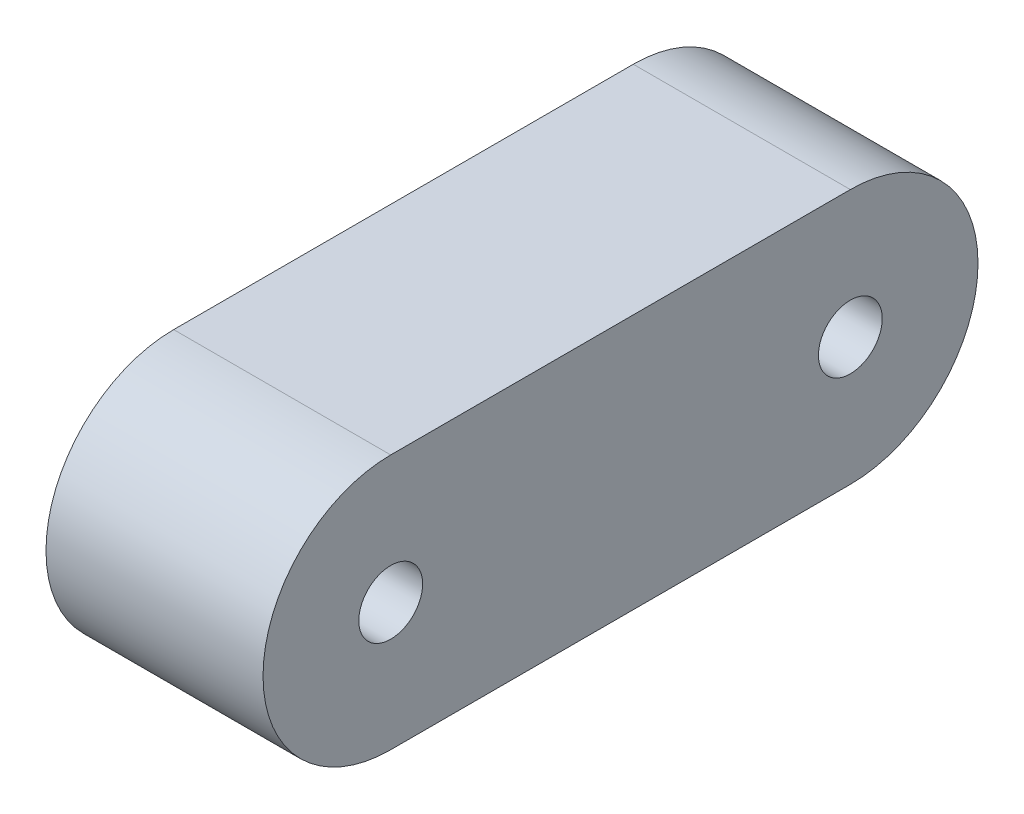
from build123d import *

# Parameters (mm, degrees)
CROQUIS1_R              = 2.5
SALIENTE_EXTRUIR1_DEPTH = 8.5


with BuildPart() as part:
    # Croquis1 → Saliente-Extruir1 (new, symmetric)
    with BuildSketch(Plane(origin=(0, 0, 0), x_dir=(0, 0, -1), z_dir=(1, 0, 0))):
        with BuildLine():
            Line((-18, 10), (18, 10))
            ThreePointArc((18, 10), (28, 0), (18, -10))
            Line((18, -10), (-18, -10))
            ThreePointArc((-18, -10), (-28, 0), (-18, 10))
        make_face()
        with Locations((-18, 0)):
            Circle(CROQUIS1_R, mode=Mode.SUBTRACT)
        with Locations((18, 0)):
            Circle(CROQUIS1_R, mode=Mode.SUBTRACT)
    extrude(amount=SALIENTE_EXTRUIR1_DEPTH, both=True)


solid = part.part
